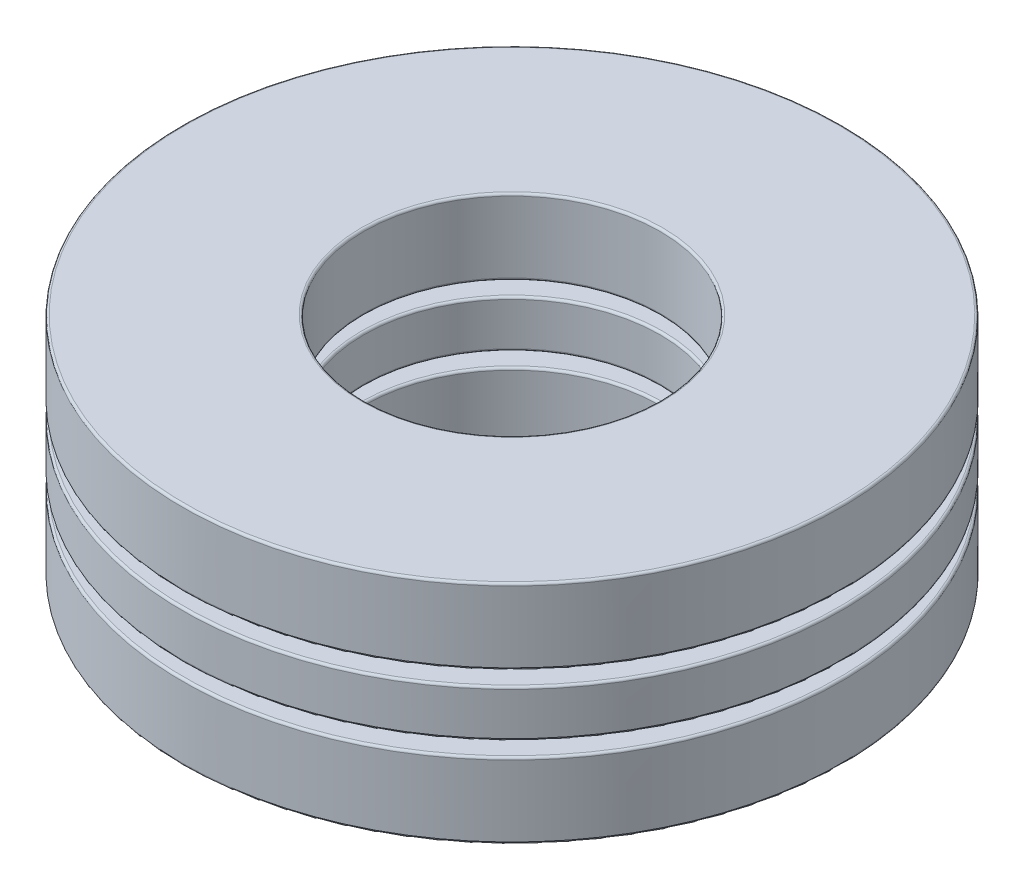
from build123d import *

# Parameters (mm, degrees)
SKETCH1_W         = 3.93065
SKETCH1_H         = 1.021291666
CIRPATTERN1_COUNT = 3
CIRPATTERN1_ANGLE = 240
CIRPATTERN2_COUNT = 3
SKETCH4_W         = 3.93065
SKETCH4_H         = 1.634066667
FILLET1_R         = 0.049022
FILLET2_R         = 0.049022
FILLET3_R         = 0.049022


with BuildPart() as part:
    # Sketch1 → Revolve1 (revolve)
    with BuildSketch(Plane(origin=(0, 0, 0), x_dir=(0, 0, -1), z_dir=(1, 0, 0)), mode=Mode.PRIVATE) as revolve1_sk:
        with Locations((-5.178425, 0)):
            Rectangle(SKETCH1_W, SKETCH1_H)
    revolve(revolve1_sk.sketch.rotate(Axis((0, -2.4511, 0), (0, 1, 0)), 180), axis=Axis((0, -2.4511, 0), (0, 1, 0)))

    # Sketch3 → Cut-Revolve1 (revolve, cut)
    with BuildSketch(Plane(origin=(0, 0, 0), x_dir=(0, 0, -1), z_dir=(1, 0, 0))):
        with BuildLine():
            Line((-5.178425, 0.817033333), (-5.178425, -0.817033333))
            ThreePointArc((-5.178425, -0.817033333), (-5.995458333, 0), (-5.178425, 0.817033333))
        make_face()
    cut_revolve1 = revolve(axis=Axis((0, 0.817033333, 5.178425), (0, -1, 0)), mode=Mode.SUBTRACT)

    # CirPattern2: Cut-Revolve1 ×3 about axis
    cirpattern2_axis = Axis((0, 0, 0), (0, 1, 0))
    for i in range(1, CIRPATTERN2_COUNT):
        add(cut_revolve1.rotate(cirpattern2_axis, i * 360 / CIRPATTERN2_COUNT), mode=Mode.SUBTRACT)

    # Fillet2
    fillet2_edges = [part.edges().sort_by_distance(p)[0] for p in [
        (0, 0.510645833, 7.14375),
        (0, 0.510645833, 3.2131),
        (0, -0.510645833, 3.2131),
        (0, -0.510645833, 7.14375),
    ]]
    fillet(fillet2_edges, radius=FILLET2_R)


with BuildPart() as body_2:
    # Sketch2 → Revolve2 (revolve)
    with BuildSketch(Plane(origin=(0, 0, 0), x_dir=(0, 0, -1), z_dir=(1, 0, 0))):
        with BuildLine():
            Line((-5.178425, 0.817033333), (-5.178425, -0.817033333))
            ThreePointArc((-5.178425, -0.817033333), (-5.995458333, 0), (-5.178425, 0.817033333))
        make_face()
    revolve(axis=Axis((0, 0.817033333, 5.178425), (0, -1, 0)))


with BuildPart() as cirpattern1_1:
    # CirPattern1: pattern copy
    add(body_2.part.rotate(Axis((0, 2.4511, 0), (0, -1, 0)), 1 * CIRPATTERN1_ANGLE / (CIRPATTERN1_COUNT - 1)))


with BuildPart() as cirpattern1_2:
    # CirPattern1: pattern copy
    add(body_2.part.rotate(Axis((0, 2.4511, 0), (0, -1, 0)), 2 * CIRPATTERN1_ANGLE / (CIRPATTERN1_COUNT - 1)))


with BuildPart() as body_5:
    # Sketch4 → Revolve3 (revolve)
    with BuildSketch(Plane(origin=(0, 0, 0), x_dir=(0, 0, -1), z_dir=(1, 0, 0)), mode=Mode.PRIVATE) as revolve3_sk:
        with Locations((-5.178425, 1.634066667)):
            Rectangle(SKETCH4_W, SKETCH4_H)
        with Locations((-5.178425, -1.634066667)):
            Rectangle(SKETCH4_W, SKETCH4_H)
    revolve(revolve3_sk.sketch.rotate(Axis((0, -2.4511, 0), (0, 1, 0)), 180), axis=Axis((0, -2.4511, 0), (0, 1, 0)))

    # Fillet1
    fillet1_edges = [body_5.edges().sort_by_distance(p)[0] for p in [
        (0, 0.817033333, 7.14375),
        (0, 0.817033333, 3.2131),
        (0, 2.4511, 3.2131),
        (0, 2.4511, 7.14375),
    ]]
    fillet(fillet1_edges, radius=FILLET1_R)

    # Fillet3
    fillet3_edges = [body_5.edges().sort_by_distance(p)[0] for p in [
        (0, -2.4511, 7.14375),
        (0, -2.4511, 3.2131),
        (0, -0.817033333, 3.2131),
        (0, -0.817033333, 7.14375),
    ]]
    fillet(fillet3_edges, radius=FILLET3_R)


solid = Compound([part.part, body_2.part, cirpattern1_1.part, cirpattern1_2.part, body_5.part])
